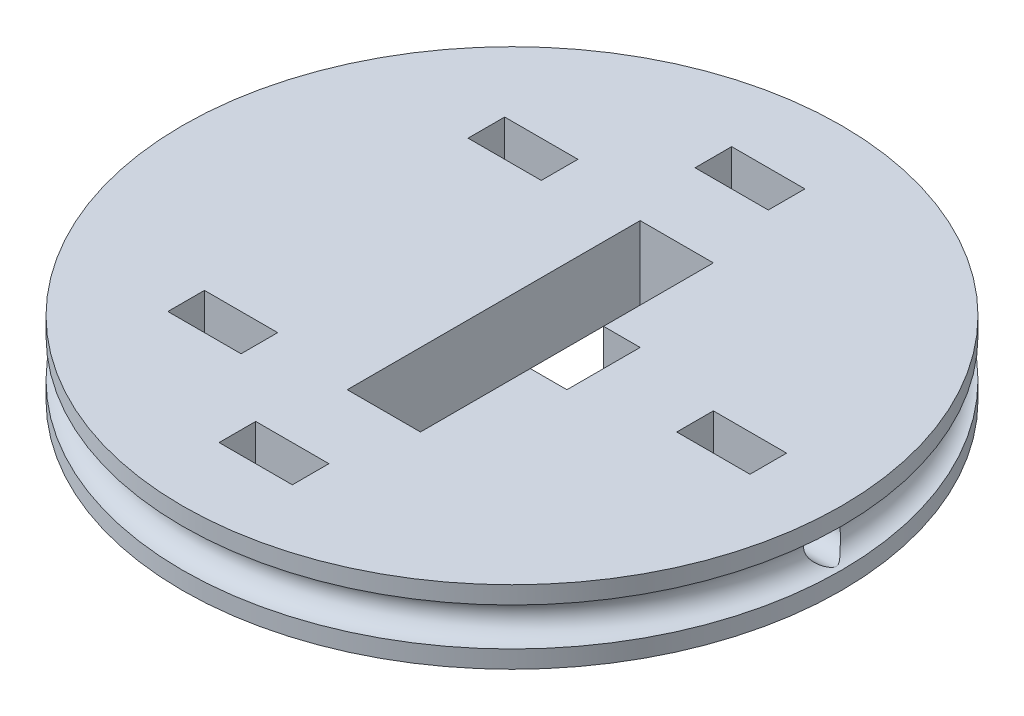
from build123d import *

# Parameters (mm, degrees)
CROQUIS2_W              = 10
CROQUIS2_H              = 5
CORTAR_EXTRUIR1_DEPTH   = 10
CROQUIS3_R              = 2.5
CORTAR_EXTRUIR2_DEPTH   = 50
SALIENTE_EXTRUIR1_DEPTH = 15
CROQUIS5_W              = 10
CROQUIS5_H              = 5
CORTAR_EXTRUIR3_DEPTH   = 10


with BuildPart() as part:
    # Croquis1 → Revolución1 (revolve)
    with BuildSketch(Plane(origin=(0, 0, 0), x_dir=(0, 0, -1), z_dir=(1, 0, 0))):
        with BuildLine():
            Line((-45, 2.6), (-45, 5))
            Line((-45, 5), (0, 5))
            Line((0, 5), (0, -5))
            Line((0, -5), (-45, -5))
            Line((-45, -5), (-45, -2.6))
            ThreePointArc((-45, -2.6), (-42.4, 0), (-45, 2.6))
        make_face()
    revolve(axis=Axis((0, 59.07084426, 0), (0, -1, 0)))

    # Croquis2 → Cortar-Extruir1 (cut)
    with BuildSketch(Plane(origin=(0, 5, 0), x_dir=(1, 0, 0), z_dir=(0, 1, 0))):
        Polygon((7.5, 5), (7.5, 20), (-2.5, 20), (-2.5, -20), (7.5, -20), (7.5, -5), (12.5, -5), (12.5, 5), align=None)
        with Locations((0, 32.5)):
            Rectangle(CROQUIS2_W, CROQUIS2_H)
        with Locations((0, -32.5)):
            Rectangle(CROQUIS2_W, CROQUIS2_H)
        with Locations((30, 0)):
            Rectangle(CROQUIS2_W, CROQUIS2_H)
    extrude(amount=-CORTAR_EXTRUIR1_DEPTH, mode=Mode.SUBTRACT)

    # Croquis3 → Cortar-Extruir2 (cut)
    with BuildSketch(Plane.ZY.offset(-12.5)):
        Circle(CROQUIS3_R)
    extrude(amount=-CORTAR_EXTRUIR2_DEPTH, mode=Mode.SUBTRACT)

    # Croquis4 → Saliente-Extruir1 (add)
    with BuildSketch(Plane(origin=(0, 5, 0), x_dir=(1, 0, 0), z_dir=(0, 1, 0))):
        Polygon((7.5, 12.5), (25, 2.5), (25, -2.5), (7.5, -12.5), (7.5, -5), (12.5, -5), (12.5, 5), (7.5, 5), align=None)
    extrude(amount=-SALIENTE_EXTRUIR1_DEPTH)

    # Croquis5 → Cortar-Extruir3 (cut)
    with BuildSketch(Plane(origin=(0, 5, 0), x_dir=(1, 0, 0), z_dir=(0, 1, 0))):
        with Locations((-19, -20.5)):
            Rectangle(CROQUIS5_W, CROQUIS5_H)
        with Locations((-19, 20.5)):
            Rectangle(CROQUIS5_W, CROQUIS5_H)
    extrude(amount=-CORTAR_EXTRUIR3_DEPTH, mode=Mode.SUBTRACT)


solid = part.part
